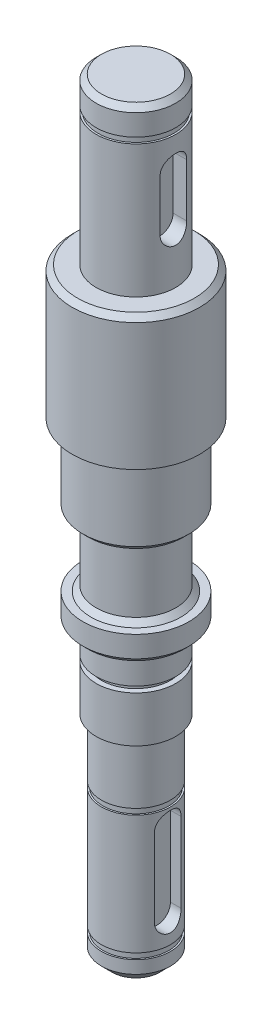
from build123d import *

# Parameters (mm, degrees)
SFAZOWANIE2_SIZE           = 1
WYTNIJ_WYCI_GNI_CIE1_DEPTH = 5.5
WYTNIJ_WYCI_GNI_CIE2_DEPTH = 6
SFAZOWANIE3_SIZE           = 2


with BuildPart() as part:
    # Szkic1 → Obrót1 (revolve)
    with BuildSketch(Plane(origin=(0, 0, 0), x_dir=(0, 0, -1), z_dir=(1, 0, 0))):
        Polygon((-3, -6.188308688), (-3, 99.409284105), (-10.5, 99.409284105), (-10.5, 94.409284105), (-10.15, 94.409284105), (-10.15, 93.309284105), (-10.5, 93.309284105), (-10.5, 68.309284105), (-15, 68.309284105), (-15, 43.309284105), (-13, 43.309284105), (-13, 28.309284105), (-10.5, 28.309284105), (-10.5, 15), (-13, 15), (-13, 10), (-10.5, 10), (-10.5, 4.778207376), (-9.5, 4.778207376), (-9.5, 3.660040364), (-10.5, 3.660040364), (-10.5, -5), (-9.5, -5), (-9.5, -15.9), (-9.2, -15.9), (-9.2, -17), (-9.5, -17), (-9.5, -39.5), (-9.2, -39.5), (-9.2, -40.6), (-9.5, -40.6), (-9.5, -45), (-3, -45), (-3, -6.690715895), align=None)
    revolve(axis=Axis((0, 99.409284105, 3), (0, -1, 0)))

    # Sfazowanie2
    sfazowanie2_edges = [part.edges().sort_by_distance(p)[0] for p in [
        (0, 68.309284105, -9),
        (0, 10, -7),
        (0, 28.309284105, -7),
        (0, 28.309284105, -4.5),
        (0, 15, -4.5),
        (0, 99.409284105, -4.5),
    ]]
    chamfer(sfazowanie2_edges, length=SFAZOWANIE2_SIZE)

    # Szkic2 → Wytnij-wyciągnięcie1 (cut)
    with BuildSketch(Plane(origin=(10, 0, 0), x_dir=(0, 0, -1), z_dir=(1, 0, 0))):
        with BuildLine():
            Line((-0.5, 87.721044176), (-0.5, 77.721044176))
            ThreePointArc((-0.5, 77.721044176), (-3, 75.221044176), (-5.5, 77.721044176))
            Line((-5.5, 77.721044176), (-5.5, 87.721044176))
            ThreePointArc((-5.5, 87.721044176), (-3, 90.221044176), (-0.5, 87.721044176))
        make_face()
    extrude(amount=-WYTNIJ_WYCI_GNI_CIE1_DEPTH, mode=Mode.SUBTRACT)

    # Szkic2<4> → Wytnij-wyciągnięcie2 (cut)
    with BuildSketch(Plane(origin=(10, 0, 0), x_dir=(0, 0, -1), z_dir=(1, 0, 0))):
        with BuildLine():
            Line((-0.5, -35.047619848), (-0.5, -20.047619848))
            ThreePointArc((-0.5, -20.047619848), (-3, -17.547619848), (-5.5, -20.047619848))
            Line((-5.5, -20.047619848), (-5.5, -35.047619848))
            ThreePointArc((-5.5, -35.047619848), (-3, -37.547619848), (-0.5, -35.047619848))
        make_face()
    extrude(amount=-WYTNIJ_WYCI_GNI_CIE2_DEPTH, mode=Mode.SUBTRACT)

    # Sfazowanie3
    sfazowanie3_edges = [part.edges().sort_by_distance(p)[0] for p in [
        (0, -45, -3.5),
    ]]
    chamfer(sfazowanie3_edges, length=SFAZOWANIE3_SIZE)


solid = part.part
